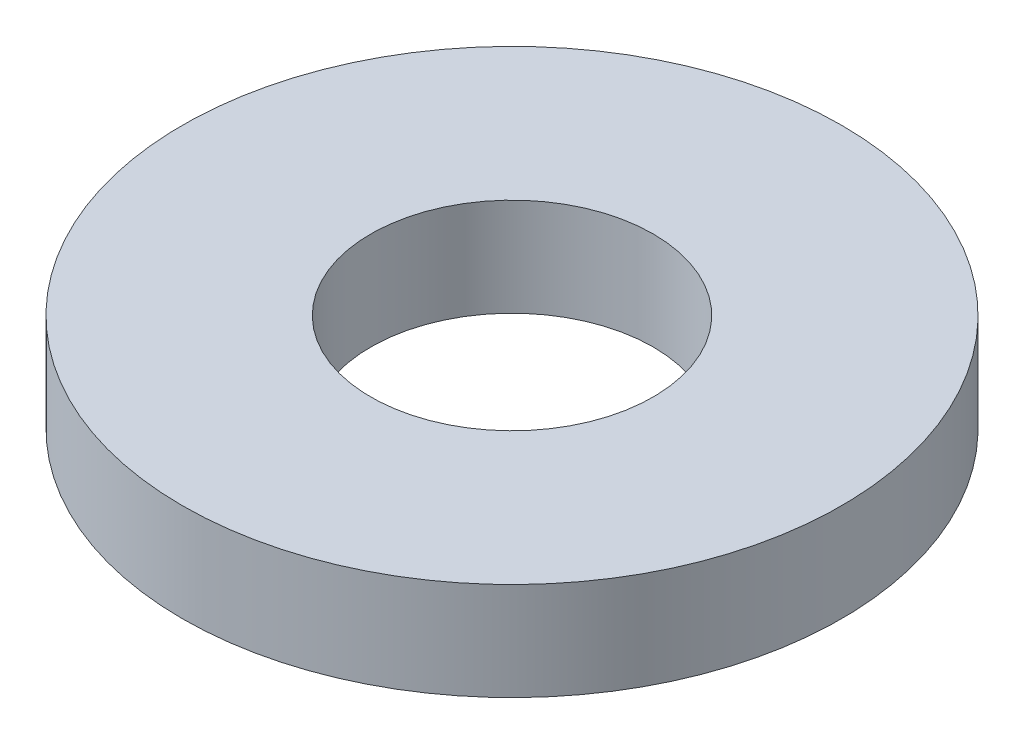
from build123d import *

# Parameters (mm, degrees)
BOSS_EXTRUDE1_DEPTH      = 0.8255
BOSS_EXTRUDE1_DEPTH_BACK = 0.8255
SKETCH2_R                = 5.55625
SKETCH2_R_2              = 2.38125


with BuildPart() as part:
    # Sketch2 → Boss-Extrude1 (new, two sides: drawn at the far end of the back side and taken through both)
    with BuildSketch(Plane(origin=(0, 0, 0), x_dir=(1, 0, 0), z_dir=(0, 1, 0)).offset(-BOSS_EXTRUDE1_DEPTH_BACK)):
        with Locations(Location((0, 0, 0), (0, 0, 90))):
            Circle(SKETCH2_R)
        with Locations(Location((0, 0, 0), (0, 0, 90))):
            Circle(SKETCH2_R_2, mode=Mode.SUBTRACT)
    extrude(amount=BOSS_EXTRUDE1_DEPTH + BOSS_EXTRUDE1_DEPTH_BACK)


solid = part.part
